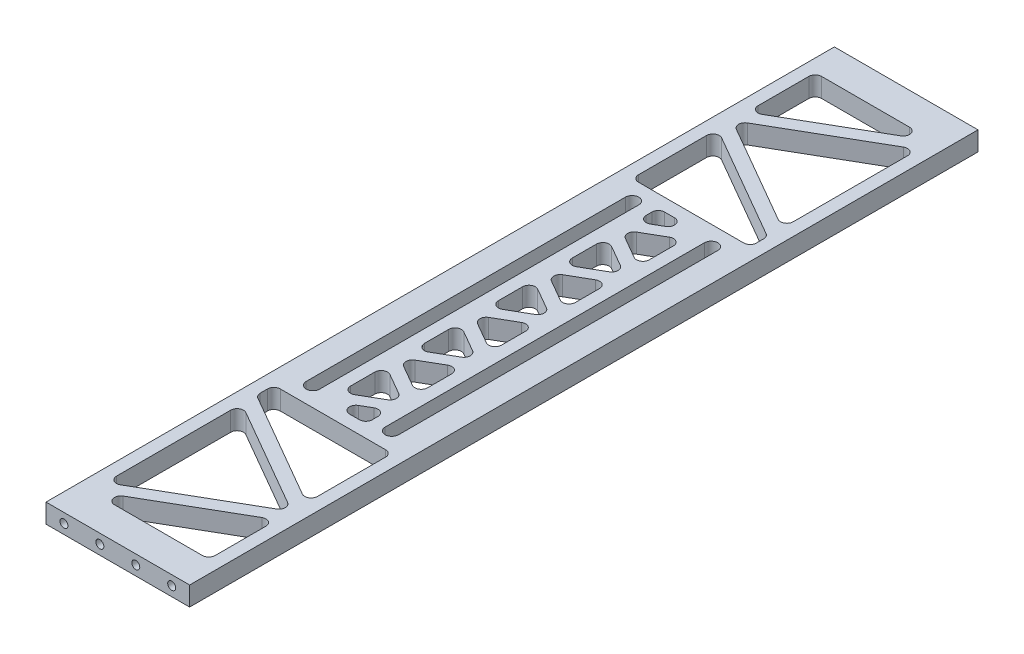
from build123d import *

# Parameters (mm, degrees)
SKETCH_1_W          = 45
SKETCH_1_H          = 247
EXTRUDE_1_DEPTH     = 6
CUT_EXTRUDE_1_DEPTH = 249.095243808
CUT_EXTRUDE_2_DEPTH = 249.095243808
FILLET_1_R          = 2
M3X0_52_D           = 2.5
M3X0_52_DEPTH       = 8.5
M3X0_52_TIP         = 0.751075774
M3X0_51_D           = 2.5
M3X0_51_DEPTH       = 8.5
M3X0_51_TIP         = 0.751075774


with BuildPart() as part:
    # Эскиз1 → Бобышка-Вытянуть1 (new body)
    with BuildSketch(Plane(origin=(0, 0, 0), x_dir=(1, 0, 0), z_dir=(0, 1, 0))):
        with Locations((0, -123.5)):
            Rectangle(SKETCH_1_W, SKETCH_1_H)
    extrude(amount=EXTRUDE_1_DEPTH)

    # Эскиз2 → Вырез-Вытянуть1 (cut, through all)
    with BuildSketch(Plane(origin=(0, 6, 0), x_dir=(1, 0, 0), z_dir=(0, 1, 0))):
        with BuildLine():
            Line((-10.274368671, -73.5), (-10.274368671, -173.5))
            ThreePointArc((-10.274368671, -173.5), (-12.374368671, -175.6), (-14.474368671, -173.5))
            Line((-14.474368671, -173.5), (-14.474368671, -73.5))
            ThreePointArc((-14.474368671, -73.5), (-12.374368671, -71.4), (-10.274368671, -73.5))
        make_face()
        with BuildLine():
            Line((10.274368671, -73.5), (10.274368671, -173.5))
            ThreePointArc((10.274368671, -173.5), (12.374368671, -175.6), (14.474368671, -173.5))
            Line((14.474368671, -173.5), (14.474368671, -73.5))
            ThreePointArc((14.474368671, -73.5), (12.374368671, -71.4), (10.274368671, -73.5))
        make_face()
    extrude(amount=-CUT_EXTRUDE_1_DEPTH, mode=Mode.SUBTRACT)

    # Эскиз14 → Вырез-Вытянуть2 (cut, through all)
    with BuildSketch(Plane(origin=(0, 6, 0), x_dir=(1, 0, 0), z_dir=(0, 1, 0))):
        Polygon((-18.5, -10), (18.5, -10), (-18.5, -31.36195996), align=None)
        Polygon((-18.5, -35.980762114), (18.5, -14.618802154), (18.5, -57.342722074), align=None)
        Polygon((-18.5, -40.599564267), (-18.5, -67.4), (18.5, -67.4), (18.5, -61.961524227), align=None)
        Polygon((6.274368671, -71.4), (-6.274368671, -78.645016882), (-6.274368671, -71.4), align=None)
        Polygon((6.274368671, -75.730127019), (-6.274368671, -82.975143901), (6.274368671, -90.220160783), align=None)
        Polygon((-6.274368671, -87.30527092), (6.274368671, -94.550287802), (-6.274368671, -101.795304684), align=None)
        Polygon((-6.274368671, -106.125431703), (6.274368671, -98.880414821), (6.274368671, -113.370448585), align=None)
        Polygon((-6.274368671, -110.455558722), (6.274368671, -117.700575604), (-6.274368671, -124.945592486), align=None)
        Polygon((-6.274368671, -129.275719505), (6.274368671, -122.030702623), (6.274368671, -136.520736387), align=None)
        Polygon((-6.274368671, -133.605846524), (6.274368671, -140.850863406), (-6.274368671, -148.095880288), align=None)
        Polygon((-6.274368671, -152.426007307), (6.274368671, -145.180990425), (6.274368671, -159.671024189), align=None)
        Polygon((-6.274368671, -156.756134326), (6.274368671, -164.001151208), (-6.274368671, -171.24616809), align=None)
        Polygon((-6.274368671, -175.576295109), (6.274368671, -168.331278227), (6.274368671, -175.576295109), align=None)
        Polygon((-18.5, -179.6), (-18.5, -185.038475773), (18.5, -206.400435733), (18.5, -179.6), align=None)
        Polygon((-18.5, -232.381197846), (-18.5, -189.657277926), (18.5, -211.019237886), align=None)
        Polygon((18.5, -215.63804004), (18.5, -237), (-18.5, -237), align=None)
    extrude(amount=-CUT_EXTRUDE_2_DEPTH, mode=Mode.SUBTRACT)

    # Скругление1
    fillet_1_edges = [part.edges().sort_by_distance(p)[0] for p in [
        (-6.274368671, 3, 101.795304684),
        (-6.274368671, 3, 87.30527092),
        (6.274368671, 3, 94.550287802),
        (6.274368671, 3, 113.370448585),
        (-6.274368671, 3, 106.125431703),
        (6.274368671, 3, 98.880414821),
        (-6.274368671, 3, 124.945592486),
        (-6.274368671, 3, 110.455558722),
        (6.274368671, 3, 117.700575604),
        (6.274368671, 3, 136.520736387),
        (-6.274368671, 3, 129.275719505),
        (6.274368671, 3, 122.030702623),
        (-6.274368671, 3, 148.095880288),
        (-6.274368671, 3, 133.605846524),
        (6.274368671, 3, 140.850863406),
        (6.274368671, 3, 159.671024189),
        (-6.274368671, 3, 152.426007307),
        (6.274368671, 3, 145.180990425),
        (-6.274368671, 3, 171.24616809),
        (-6.274368671, 3, 156.756134326),
        (6.274368671, 3, 164.001151208),
        (6.274368671, 3, 175.576295109),
        (-6.274368671, 3, 175.576295109),
        (6.274368671, 3, 168.331278227),
        (-18.5, 3, 179.6),
        (18.5, 3, 179.6),
        (18.5, 3, 206.400435733),
        (-18.5, 3, 185.038475773),
        (18.5, 3, 211.019237886),
        (-18.5, 3, 232.381197846),
        (-18.5, 3, 189.657277926),
        (-18.5, 3, 237),
        (18.5, 3, 215.63804004),
        (18.5, 3, 237),
        (-18.5, 3, 31.36195996),
        (-18.5, 3, 10),
        (18.5, 3, 10),
        (18.5, 3, 57.342722074),
        (-18.5, 3, 35.980762114),
        (18.5, 3, 14.618802154),
        (-18.5, 3, 40.599564267),
        (18.5, 3, 61.961524227),
        (18.5, 3, 67.4),
        (-18.5, 3, 67.4),
        (-6.274368671, 3, 71.4),
        (6.274368671, 3, 71.4),
        (-6.274368671, 3, 78.645016882),
        (6.274368671, 3, 75.730127019),
        (6.274368671, 3, 90.220160783),
        (-6.274368671, 3, 82.975143901),
    ]]
    fillet(fillet_1_edges, radius=FILLET_1_R)

    # Отверстие обработанное метчиком M3x0.52
    with Locations(Plane(origin=(0, 0, 0), x_dir=(-1, 0, 0), z_dir=(0, 0, -1))):
        with Locations((-16.875, 3), (-5.625, 3), (5.625, 3), (16.875, 3)):
            Hole(M3X0_52_D / 2, depth=M3X0_52_DEPTH)
            with Locations((0, 0, -(M3X0_52_DEPTH + M3X0_52_TIP / 2))):  # 118° drill point
                Cone(0, M3X0_52_D / 2, M3X0_52_TIP, mode=Mode.SUBTRACT)

    # Отверстие обработанное метчиком M3x0.51
    with Locations(Plane.XY.offset(247)):
        with Locations((-16.875, 3), (-5.625, 3), (5.625, 3), (16.875, 3)):
            Hole(M3X0_51_D / 2, depth=M3X0_51_DEPTH)
            with Locations((0, 0, -(M3X0_51_DEPTH + M3X0_51_TIP / 2))):  # 118° drill point
                Cone(0, M3X0_51_D / 2, M3X0_51_TIP, mode=Mode.SUBTRACT)


solid = part.part
